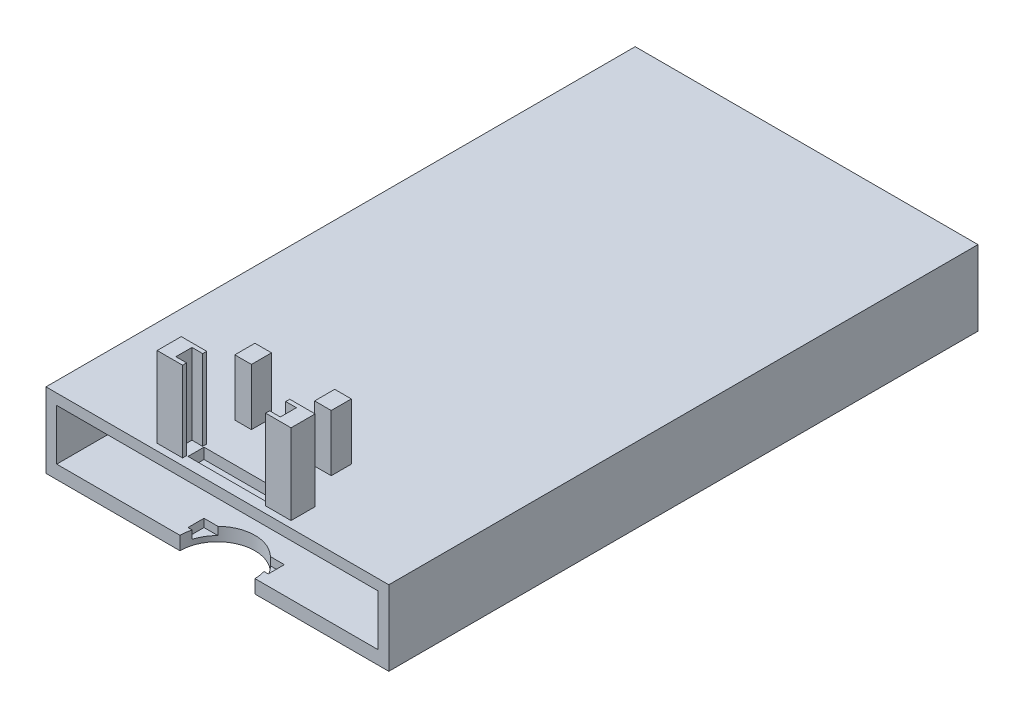
from build123d import *

# Parameters (mm, degrees)
ESQUISSE1_W                   = 128
ESQUISSE1_H                   = 28
ESQUISSE1_W_2                 = 120
ESQUISSE1_H_2                 = 19
CORPS_CASIER_DEPTH            = 220
PAROI_FOND_START              = -215
ESQUISSE2_W                   = 120
ESQUISSE2_H                   = 19
ESQUISSE2_W_2                 = 21
ESQUISSE2_H_2                 = 11
PAROI_FOND_DEPTH              = 5
ESQUISSE3_W                   = 6
ESQUISSE3_H                   = 6
ESQUISSE3_H_2                 = 4
FENTE_ET_ENCOCHE_VERROU_DEPTH = 15
ESQUISSE4_R                   = 14
ENCOCHE_PRISE_DOIGT_DEPTH     = 6
GLISSIERES_VERROU_START       = 28
GLISSIERES_VERROU_DEPTH       = 30
SUPPORTS_SERVO_SG90_START     = 28
ESQUISSE6_W                   = 6.2
ESQUISSE6_H                   = 7.5
SUPPORTS_SERVO_SG90_DEPTH     = 21.1


with BuildPart() as part:
    # Esquisse1 → Corps_casier (new body)
    with BuildSketch(Plane.XY):
        with Locations((0, 14)):
            Rectangle(ESQUISSE1_W, ESQUISSE1_H)
        with Locations((0, 14.5)):
            Rectangle(ESQUISSE1_W_2, ESQUISSE1_H_2, mode=Mode.SUBTRACT)
    extrude(amount=-CORPS_CASIER_DEPTH)

    # Esquisse2 → Paroi_fond (add)
    with BuildSketch(Plane.XY.offset(PAROI_FOND_START)):
        with Locations((0, 14.5)):
            Rectangle(ESQUISSE2_W, ESQUISSE2_H)
        with Locations((0, 14)):
            Rectangle(ESQUISSE2_W_2, ESQUISSE2_H_2, mode=Mode.SUBTRACT)
    extrude(amount=-PAROI_FOND_DEPTH)

    # Esquisse3 → Fente_et_encoche_verrou (cut, symmetric)
    with BuildSketch(Plane(origin=(0, 0, 0), x_dir=(0, 0, -1), z_dir=(1, 0, 0))):
        with Locations((7, 26)):
            Rectangle(ESQUISSE3_W, ESQUISSE3_H)
        with Locations((7, 4)):
            Rectangle(ESQUISSE3_W, ESQUISSE3_H_2)
    extrude(amount=FENTE_ET_ENCOCHE_VERROU_DEPTH, both=True, mode=Mode.SUBTRACT)

    # Esquisse4 → Encoche_prise_doigt (cut)
    with BuildSketch(Plane(origin=(0, 0, 0), x_dir=(1, 0, 0), z_dir=(0, 1, 0))):
        Circle(ESQUISSE4_R)
    extrude(amount=ENCOCHE_PRISE_DOIGT_DEPTH, mode=Mode.SUBTRACT)

    # Esquisse5 → Glissieres_verrou (add)
    with BuildSketch(Plane(origin=(0, 0, 0), x_dir=(1, 0, 0), z_dir=(0, 1, 0)).offset(GLISSIERES_VERROU_START)):
        Polygon((-25, 2.5), (-15.5, 2.5), (-15.5, 4), (-19.5, 4), (-19.5, 10), (-15.5, 10), (-15.5, 11.5), (-25, 11.5), align=None)
        Polygon((25, 2.5), (15.5, 2.5), (15.5, 4), (19.5, 4), (19.5, 10), (15.5, 10), (15.5, 11.5), (25, 11.5), align=None)
    extrude(amount=GLISSIERES_VERROU_DEPTH)

    # Esquisse6 → Supports_servo_SG90 (add)
    with BuildSketch(Plane(origin=(0, 0, 0), x_dir=(1, 0, 0), z_dir=(0, 1, 0)).offset(SUPPORTS_SERVO_SG90_START)):
        with Locations((-14.9, 28.25)):
            Rectangle(ESQUISSE6_W, ESQUISSE6_H)
        with Locations((14.9, 28.25)):
            Rectangle(ESQUISSE6_W, ESQUISSE6_H)
    extrude(amount=SUPPORTS_SERVO_SG90_DEPTH)


solid = part.part
